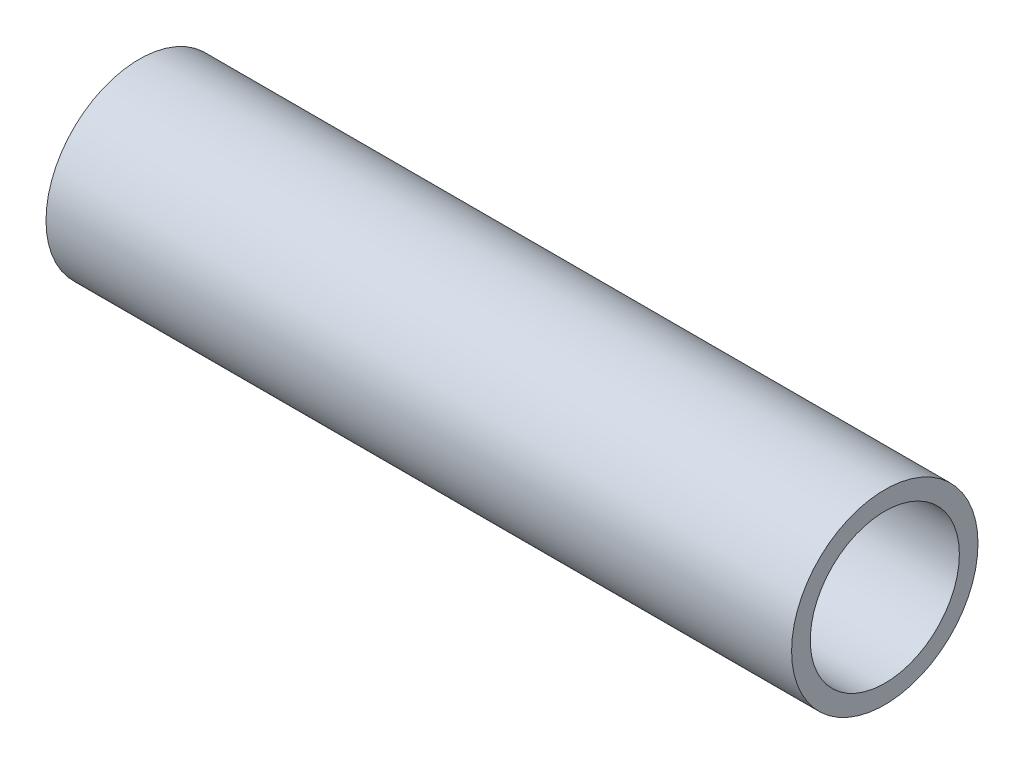
from build123d import *

# Parameters (mm, degrees)
SKIZZE1_R                       = 1.25
SKIZZE1_R_2                     = 1
AUFSATZ_LINEAR_AUSTRAGEN1_DEPTH = 5


with BuildPart() as part:
    # Skizze1 → Aufsatz-Linear austragen1 (new, symmetric)
    with BuildSketch(Plane(origin=(0, 0, 0), x_dir=(0, 0, -1), z_dir=(1, 0, 0))):
        Circle(SKIZZE1_R)
        Circle(SKIZZE1_R_2, mode=Mode.SUBTRACT)
    extrude(amount=AUFSATZ_LINEAR_AUSTRAGEN1_DEPTH, both=True)


solid = part.part
